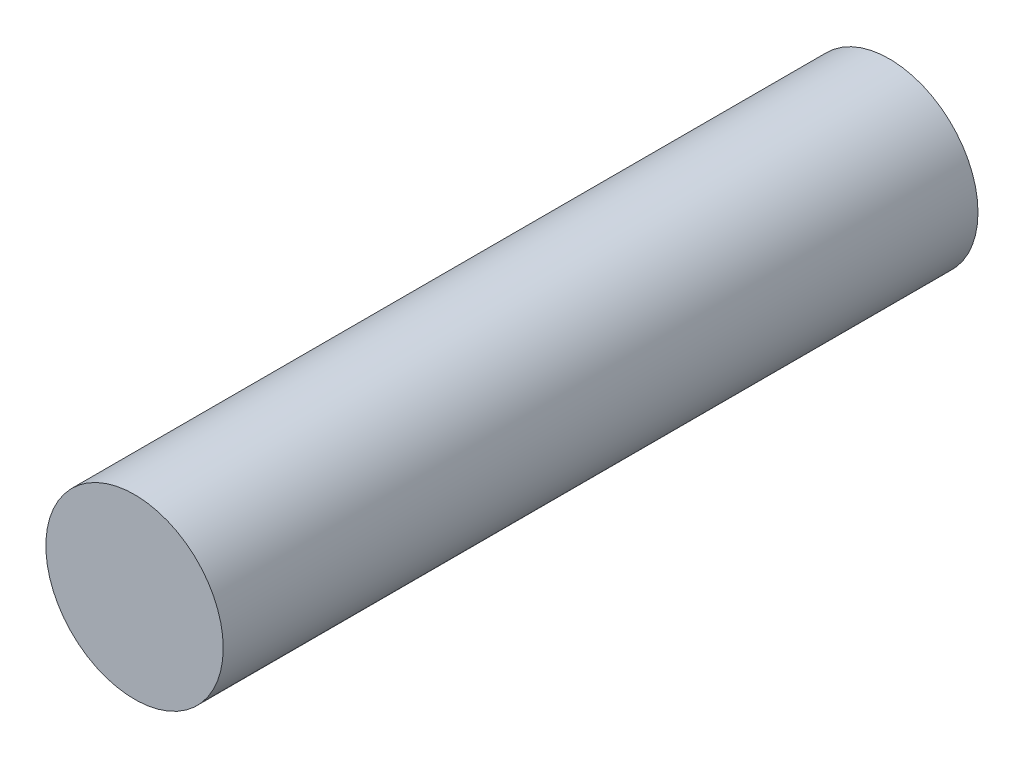
from build123d import *

# Parameters (mm, degrees)
SKETCH1_R           = 2.35
BOSS_EXTRUDE1_DEPTH = 20


with BuildPart() as part:
    # Sketch1 → Boss-Extrude1 (new body)
    with BuildSketch(Plane.XY):
        Circle(SKETCH1_R)
    extrude(amount=BOSS_EXTRUDE1_DEPTH)


solid = part.part
